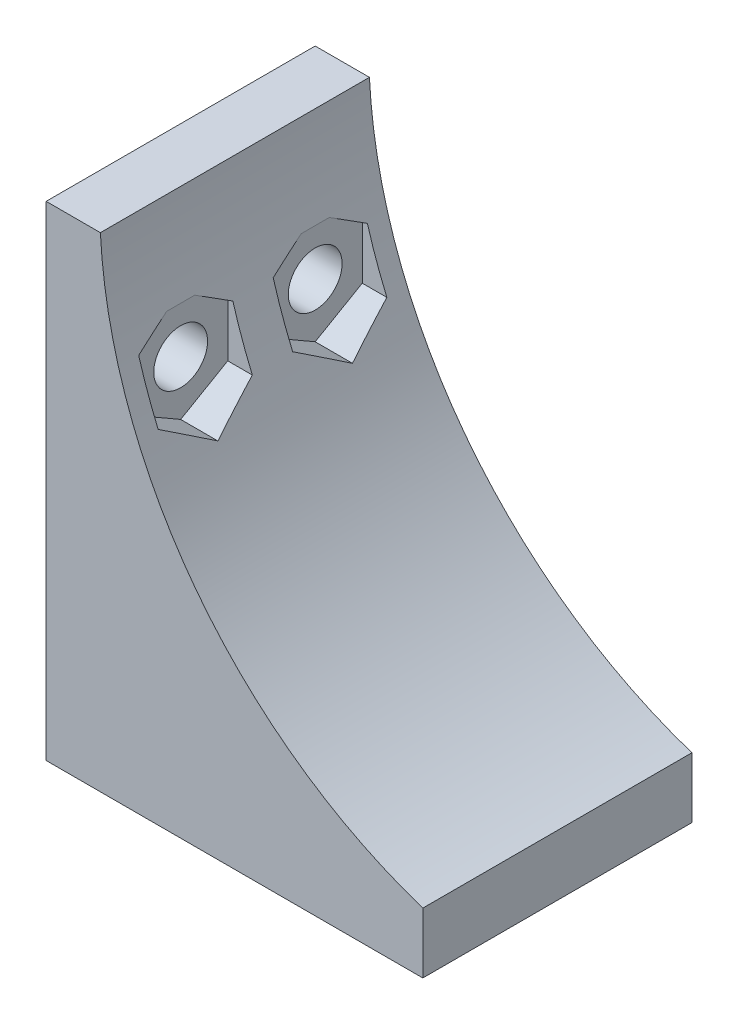
from build123d import *

# Parameters (mm, degrees)
EXTRUDE_1_DEPTH     = 10
SKETCH_2_R          = 2
CUT_EXTRUDE_2_DEPTH = 10
CUT_EXTRUDE_3_DEPTH = 20


with BuildPart() as part:
    # 草图1 → 凸台-拉伸1 (new, symmetric)
    with BuildSketch(Plane.XY):
        with BuildLine():
            Line((0, 36), (0, 0))
            Line((0, 0), (28, 0))
            Line((28, 0), (28, 4.5))
            ThreePointArc((28, 4.5), (11.156427167, 16.552318383), (4.032383098, 36))
            Line((4.032383098, 36), (0, 36))
        make_face()
    extrude(amount=EXTRUDE_1_DEPTH, both=True)

    # 草图2 → 切除-拉伸2 (cut, symmetric)
    with BuildSketch(Plane(origin=(0, 0, 0), x_dir=(0, 0, -1), z_dir=(1, 0, 0))):
        with Locations((-5, 26)):
            Circle(SKETCH_2_R)
        with Locations((5, 26)):
            Circle(SKETCH_2_R)
    extrude(amount=CUT_EXTRUDE_2_DEPTH, both=True, mode=Mode.SUBTRACT)

    # 草图3 → 切除-拉伸3 (cut)
    with BuildSketch(Plane(origin=(5, 0, 0), x_dir=(0, 0, -1), z_dir=(1, 0, 0))):
        Polygon((-5, 30.041451884), (-8.5, 28.020725942), (-8.5, 23.979274058), (-5, 21.958548116), (-1.5, 23.979274058), (-1.5, 28.020725942), align=None)
        Polygon((5, 30.041451884), (1.5, 28.020725942), (1.5, 23.979274058), (5, 21.958548116), (8.5, 23.979274058), (8.5, 28.020725942), align=None)
    extrude(amount=CUT_EXTRUDE_3_DEPTH, mode=Mode.SUBTRACT)


solid = part.part
